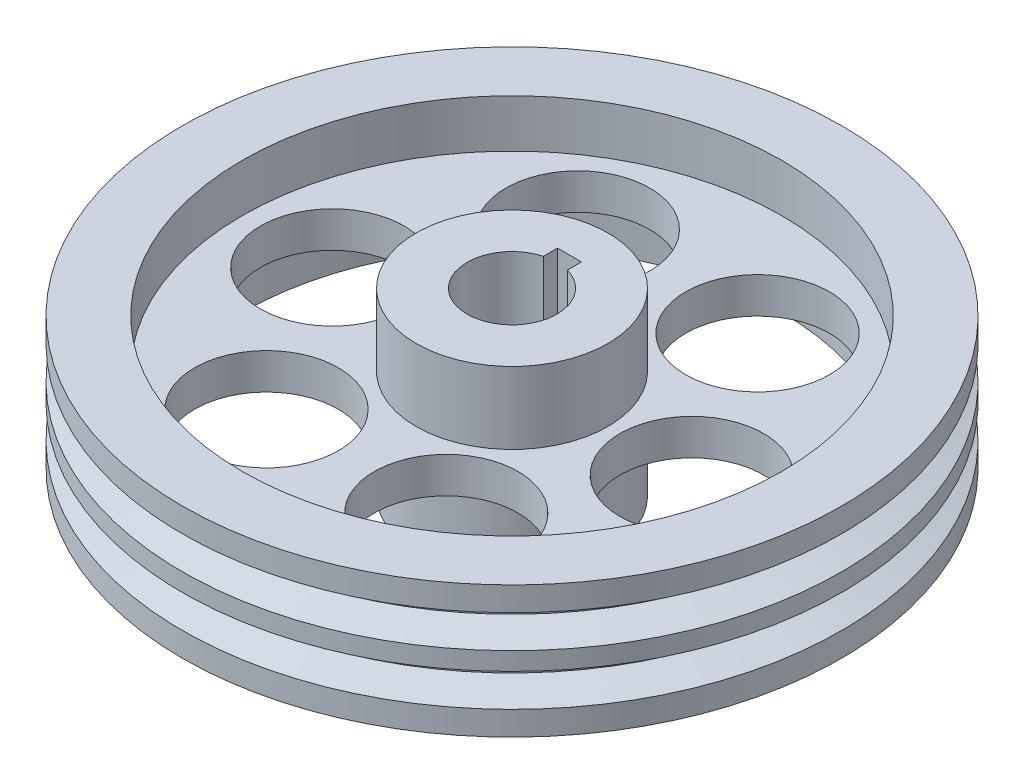
from build123d import *

# Parameters (mm, degrees)
SKETCH_1_R      = 16
EXTRUDE_1_DEPTH = 15
SKETCH_2_R      = 45
SKETCH_2_R_2    = 12
EXTRUDE_3_DEPTH = 3
SKETCH_3_R      = 55
SKETCH_3_R_2    = 45
EXTRUDE_4_DEPTH = 11


with BuildPart() as part:
    # 草图1 → 凸台-拉伸1 (new, symmetric)
    with BuildSketch(Plane(origin=(0, 0, 0), x_dir=(1, 0, 0), z_dir=(0, 1, 0))):
        with Locations(Location((0, 0, 0), (0, 0, 270))):
            Circle(SKETCH_1_R)
        with BuildLine():
            ThreePointArc((2, 7.228416147), (0, -7.5), (-2, 7.228416147))
            Line((-2, 7.228416147), (-2, 9.6))
            Line((-2, 9.6), (2, 9.6))
            Line((2, 9.6), (2, 7.228416147))
        make_face(mode=Mode.SUBTRACT)
    extrude(amount=EXTRUDE_1_DEPTH, both=True)

    # 草图2 → 凸台-拉伸3 (add, symmetric)
    with BuildSketch(Plane(origin=(0, 0, 0), x_dir=(1, 0, 0), z_dir=(0, 1, 0))):
        with Locations(Location((0, 0, 0), (0, 0, 270))):
            Circle(SKETCH_2_R)
        with Locations(Location((-30, 0, 0), (0, 0, 270))):
            Circle(SKETCH_2_R_2, mode=Mode.SUBTRACT)
        with Locations(Location((-15, 25.980762114, 0), (0, 0, 270))):
            Circle(SKETCH_2_R_2, mode=Mode.SUBTRACT)
        with Locations(Location((15, 25.980762114, 0), (0, 0, 270))):
            Circle(SKETCH_2_R_2, mode=Mode.SUBTRACT)
        with Locations(Location((30, 0, 0), (0, 0, 270))):
            Circle(SKETCH_2_R_2, mode=Mode.SUBTRACT)
        with Locations(Location((15, -25.980762114, 0), (0, 0, 270))):
            Circle(SKETCH_2_R_2, mode=Mode.SUBTRACT)
        with Locations(Location((-15, -25.980762114, 0), (0, 0, 270))):
            Circle(SKETCH_2_R_2, mode=Mode.SUBTRACT)
    extrude(amount=EXTRUDE_3_DEPTH, both=True)

    # 草图3 → 凸台-拉伸4 (add, symmetric)
    with BuildSketch(Plane(origin=(0, 0, 0), x_dir=(1, 0, 0), z_dir=(0, 1, 0))):
        with Locations(Location((0, 0, 0), (0, 0, 270))):
            Circle(SKETCH_3_R)
        with Locations(Location((0, 0, 0), (0, 0, 270))):
            Circle(SKETCH_3_R_2, mode=Mode.SUBTRACT)
    extrude(amount=EXTRUDE_4_DEPTH, both=True)

    # 草图4 → 切除-旋转1 (revolve, cut)
    with BuildSketch(Plane.XY, mode=Mode.PRIVATE) as cut_revolve_1_sk:
        Polygon((-55, 1.5), (-50, 3.221638066), (-50, 5.263530397), (-55, 6.985168464), align=None)
        Polygon((-55, -1.5), (-50, -3.221638066), (-50, -5.263530397), (-55, -6.985168464), align=None)
    revolve(cut_revolve_1_sk.sketch.rotate(Axis((0, -16.5, 0), (0, 1, 0)), 270), axis=Axis((0, -16.5, 0), (0, 1, 0)), mode=Mode.SUBTRACT)


solid = part.part
